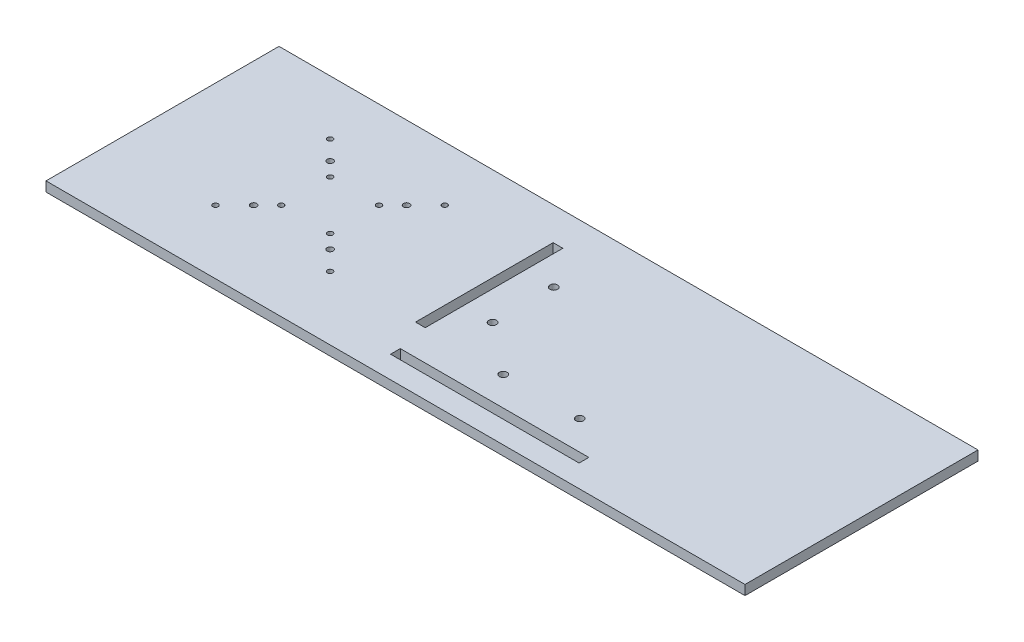
from build123d import *

# Parameters (mm, degrees)
SKETCH1_W           = 457.2
SKETCH1_H           = 152.4
SKETCH1_R           = 1.75
SKETCH1_R_2         = 2.5
SKETCH1_R_3         = 2
SKETCH1_W_2         = 123.32
SKETCH1_H_2         = 6.35
SKETCH1_W_3         = 6.35
SKETCH1_H_3         = 90
BOSS_EXTRUDE1_DEPTH = 6.35


with BuildPart() as part:
    # Sketch1 → Boss-Extrude1 (new body)
    with BuildSketch(Plane(origin=(0, 0, 0), x_dir=(1, 0, 0), z_dir=(0, 1, 0))):
        with Locations((228.6, 76.2)):
            Rectangle(SKETCH1_W, SKETCH1_H)
        with Locations(Location((90.702581284, 95.13, 0), (0, 0, 270))):
            Circle(SKETCH1_R, mode=Mode.SUBTRACT)
        with Locations(Location((122.702581284, 95.13, 0), (0, 0, 270))):
            Circle(SKETCH1_R, mode=Mode.SUBTRACT)
        with Locations(Location((122.702581284, 63.13, 0), (0, 0, 270))):
            Circle(SKETCH1_R, mode=Mode.SUBTRACT)
        with Locations(Location((90.702581284, 63.13, 0), (0, 0, 270))):
            Circle(SKETCH1_R, mode=Mode.SUBTRACT)
        with Locations(Location((69.202581284, 116.63, 0), (0, 0, 270))):
            Circle(SKETCH1_R, mode=Mode.SUBTRACT)
        with Locations(Location((144.202581284, 116.63, 0), (0, 0, 270))):
            Circle(SKETCH1_R, mode=Mode.SUBTRACT)
        with Locations(Location((144.202581284, 41.63, 0), (0, 0, 270))):
            Circle(SKETCH1_R, mode=Mode.SUBTRACT)
        with Locations(Location((69.202581284, 41.63, 0), (0, 0, 270))):
            Circle(SKETCH1_R, mode=Mode.SUBTRACT)
        with Locations(Location((226.25, 65.86, 0), (0, 0, 270))):
            Circle(SKETCH1_R_2, mode=Mode.SUBTRACT)
        with Locations(Location((226.25, 105.86, 0), (0, 0, 270))):
            Circle(SKETCH1_R_2, mode=Mode.SUBTRACT)
        with Locations(Location((259.17, 39.91, 0), (0, 0, 270))):
            Circle(SKETCH1_R_2, mode=Mode.SUBTRACT)
        with Locations(Location((309.17, 39.91, 0), (0, 0, 270))):
            Circle(SKETCH1_R_2, mode=Mode.SUBTRACT)
        with Locations(Location((81.702581284, 104.13, 0), (0, 0, 270))):
            Circle(SKETCH1_R_3, mode=Mode.SUBTRACT)
        with Locations(Location((131.702581284, 104.13, 0), (0, 0, 270))):
            Circle(SKETCH1_R_3, mode=Mode.SUBTRACT)
        with Locations(Location((131.702581284, 54.13, 0), (0, 0, 270))):
            Circle(SKETCH1_R_3, mode=Mode.SUBTRACT)
        with Locations(Location((81.702581284, 54.13, 0), (0, 0, 270))):
            Circle(SKETCH1_R_3, mode=Mode.SUBTRACT)
        with Locations((272.51, 17.685)):
            Rectangle(SKETCH1_W_2, SKETCH1_H_2, mode=Mode.SUBTRACT)
        with Locations((204.025, 85.86)):
            Rectangle(SKETCH1_W_3, SKETCH1_H_3, mode=Mode.SUBTRACT)
    extrude(amount=BOSS_EXTRUDE1_DEPTH)


solid = part.part
